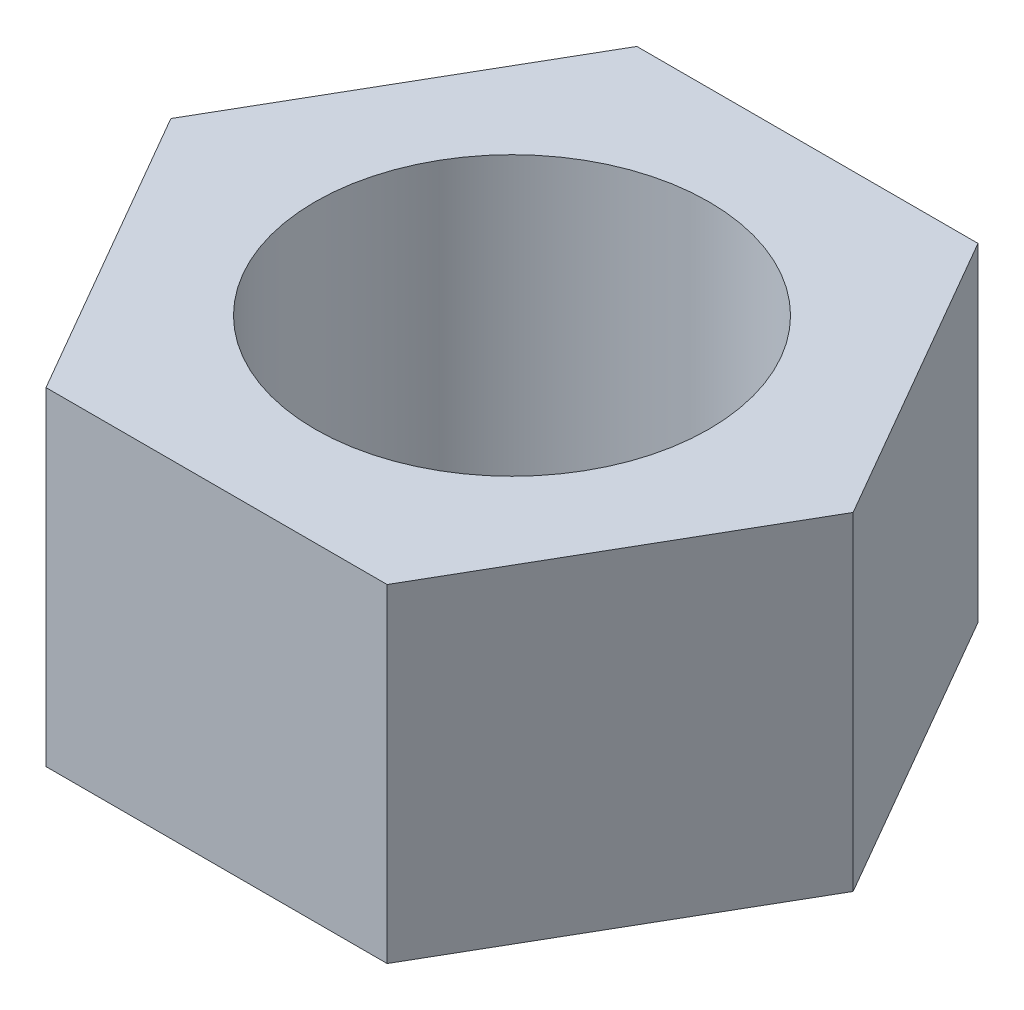
from build123d import *

# Parameters (mm, degrees)
BOSS_EXTRUDE1_DEPTH = 2.5
SKETCH2_R           = 1.5
CUT_EXTRUDE1_DEPTH  = 2.5


with BuildPart() as part:
    # Sketch1 → Boss-Extrude1 (new body)
    with BuildSketch(Plane(origin=(0, 0, 0), x_dir=(1, 0, 0), z_dir=(0, 1, 0))):
        Polygon((1.299038106, -2.25), (2.598076211, 0), (1.299038106, 2.25), (-1.299038106, 2.25), (-2.598076211, 0), (-1.299038106, -2.25), align=None)
    extrude(amount=BOSS_EXTRUDE1_DEPTH)

    # Sketch2 → Cut-Extrude1 (cut)
    with BuildSketch(Plane(origin=(0, 2.5, 0), x_dir=(1, 0, 0), z_dir=(0, 1, 0))):
        with Locations(Location((0, 0, 0), (0, 0, 270))):
            Circle(SKETCH2_R)
    extrude(amount=-CUT_EXTRUDE1_DEPTH, mode=Mode.SUBTRACT)


solid = part.part
